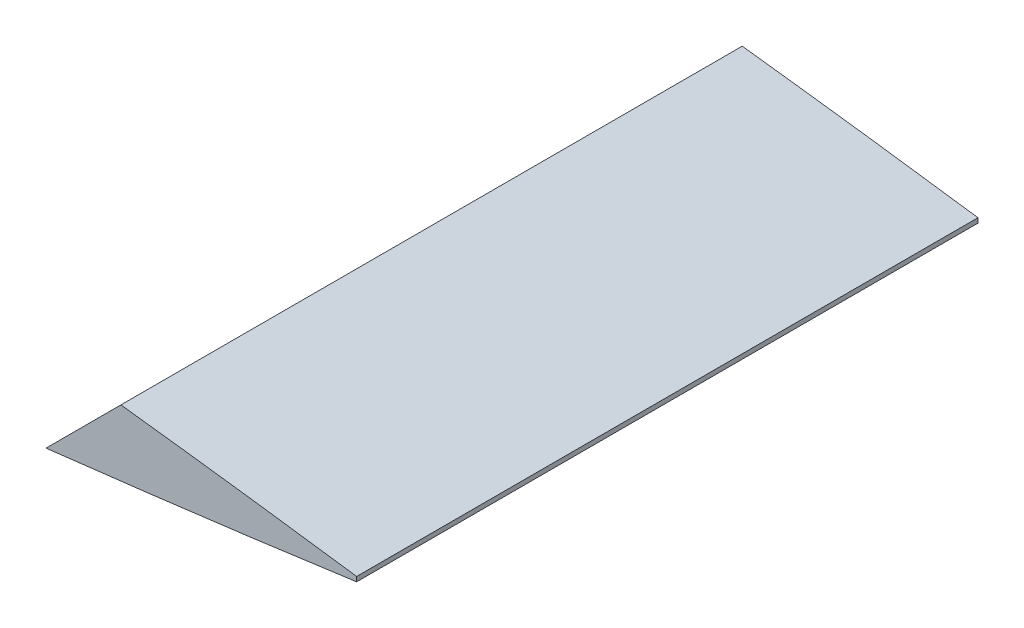
from build123d import *

# Parameters (mm, degrees)
BOSS_EXTRUDE1_DEPTH     = 100
CUT_EXTRUDE8_DEPTH      = 317.739843694
CUT_EXTRUDE8_DEPTH_BACK = 317.739843694
SKETCH9_OUTSIDE_W       = 365.654
SKETCH9_OUTSIDE_H       = 165.654
SKETCH9_OUTSIDE_W_2     = 50
SKETCH9_OUTSIDE_H_2     = 100
CUT_EXTRUDE9_DEPTH      = 317.299560542


with BuildPart() as part:
    # Sketch5 → Boss-Extrude1 (new body)
    with BuildSketch(Plane.XY):
        with BuildLine():
            Line((300, 0.378), (300, -0.378))
            add(Edge.make_bspline(
                [(300, 0.378), (299.270406424, 0.479445822), (297.234667094, 0.762503754), (293.659650161, 1.257673506), (289.112411795, 1.874242443), (284.080816659, 2.54451744), (278.752044218, 3.238122316), (273.265899022, 3.934946436), (267.705955472, 4.629019943), (262.11456302, 5.313069107), (256.508348909, 5.982191812), (250.891738994, 6.637990809), (245.269556965, 7.281779235), (239.647345349, 7.912232764), (234.025130107, 8.526992046), (228.399087903, 9.126229764), (222.768257645, 9.713077606), (217.135920793, 10.28745981), (211.505410154, 10.846941084), (205.877619803, 11.391642827), (200.251512374, 11.920884624), (194.626420536, 12.434617078), (189.002797137, 12.931911809), (183.381530938, 13.413097581), (177.763225616, 13.876376701), (172.148301533, 14.321237194), (166.537529462, 14.747820918), (160.931736194, 15.154228144), (155.33170885, 15.539100856), (149.737538345, 15.902649564), (144.148688279, 16.241846119), (138.565679604, 16.557420546), (132.990859803, 16.847397555), (127.42743944, 17.110211679), (121.877619637, 17.343891718), (116.340758577, 17.545256813), (110.815476382, 17.71267912), (105.301273398, 17.844497938), (99.800570116, 17.940091813), (94.317435844, 17.996590439), (88.855764067, 18.010124458), (83.418647975, 17.97923384), (78.008480827, 17.899160713), (72.628455365, 17.767033787), (67.282738746, 17.579413934), (61.977364895, 17.331515489), (56.720691016, 17.021032651), (51.525175322, 16.64095807), (46.408202619, 16.190188591), (41.394176065, 15.661669099), (36.515671087, 15.053963784), (31.819009441, 14.365623605), (27.366164829, 13.603475684), (23.235217954, 12.782583444), (19.502642451, 11.920250751), (16.218271393, 11.044597796), (13.389186016, 10.175076255), (10.984929333, 9.333498715), (8.961561478, 8.522062882), (7.267292053, 7.746976002), (5.846052466, 7.010625622), (4.647711085, 6.300634033), (3.628235251, 5.606513668), (2.751909197, 4.926635252), (2.00625736, 4.249917259), (1.390586137, 3.570259492), (0.901000435, 2.890942252), (0.529275535, 2.220219273), (0.260479537, 1.566458936), (0.085712654, 0.931035928), (-0.003509247, 0.308981015), (-0.003509247, -0.308981015), (0.085712654, -0.931035928), (0.260479537, -1.566458936), (0.529275535, -2.220219273), (0.901000435, -2.890942252), (1.390586137, -3.570259492), (2.00625736, -4.249917259), (2.751909197, -4.926635252), (3.628235251, -5.606513668), (4.647711085, -6.300634033), (5.846052466, -7.010625622), (7.267292053, -7.746975999), (8.961561475, -8.522062895), (10.984929344, -9.333498651), (13.389185965, -10.175076559), (16.21827163, -11.044596377), (19.502641361, -11.92025728), (23.235222799, -12.782554413), (27.366127559, -13.603596161), (31.819075008, -14.365113363), (36.515634637, -15.054106097), (41.394182204, -15.661628887), (46.408200924, -16.190199694), (51.525175786, -16.640955027), (56.720690889, -17.02103348), (61.977364929, -17.331515263), (67.282738736, -17.579413995), (72.628455367, -17.767033771), (78.008480826, -17.899160717), (83.418647975, -17.979233839), (88.855764067, -18.010124458), (94.317435844, -17.996590438), (99.800570116, -17.940091813), (105.301273398, -17.844497938), (110.815476382, -17.71267912), (116.340758577, -17.545256813), (121.877619637, -17.343891718), (127.42743944, -17.110211679), (132.990859803, -16.847397555), (138.565679604, -16.557420546), (144.148688279, -16.241846119), (149.737538345, -15.902649564), (155.33170885, -15.539100856), (160.931736194, -15.154228144), (166.537529462, -14.747820918), (172.148301533, -14.321237194), (177.763225616, -13.876376701), (183.381530938, -13.413097581), (189.002797137, -12.931911809), (194.626420536, -12.434617078), (200.251512374, -11.920884624), (205.877619803, -11.391642827), (211.505410154, -10.846941084), (217.135920793, -10.28745981), (222.768257645, -9.713077606), (228.399087903, -9.126229764), (234.025130107, -8.526992046), (239.647345349, -7.912232764), (245.269556965, -7.281779235), (250.891738994, -6.637990809), (256.508348909, -5.982191812), (262.11456302, -5.313069107), (267.705955472, -4.629019943), (273.265899022, -3.934946436), (278.752044218, -3.238122316), (284.080816659, -2.54451744), (289.112411795, -1.874242443), (293.659650161, -1.257673506), (297.234667094, -0.762503754), (299.270406424, -0.479445822), (300, -0.378)],
                knots=[0, 0, 0, 0, 0.003612221, 0.010078953, 0.017698618, 0.026115111, 0.034970966, 0.04405038, 0.05323433, 0.06244757, 0.071673993, 0.080921319, 0.090177538, 0.099424342, 0.108664441, 0.117912199, 0.127169502, 0.136426595, 0.145675426, 0.154916495, 0.164153237, 0.173386649, 0.182615736, 0.191838089, 0.201053134, 0.210260393, 0.219458942, 0.228646747, 0.237822316, 0.246985224, 0.256137384, 0.265279416, 0.27440695, 0.283512193, 0.292591781, 0.301646285, 0.310681793, 0.319699068, 0.32869452, 0.33766016, 0.346588583, 0.355477412, 0.364322937, 0.373121614, 0.381867635, 0.390553005, 0.399166026, 0.407689628, 0.416098119, 0.424354887, 0.432412429, 0.440204728, 0.447630505, 0.454563638, 0.460855379, 0.466413319, 0.47122861, 0.475365774, 0.47890126, 0.481915077, 0.484498872, 0.486747127, 0.488741252, 0.490543179, 0.492182104, 0.493672831, 0.495031908, 0.49627906, 0.497424737, 0.498490166, 0.499502758, 0.500497254, 0.501509846, 0.502575275, 0.503720952, 0.504968104, 0.506327181, 0.507817908, 0.509456832, 0.51125876, 0.513252884, 0.51550114, 0.518084934, 0.521098752, 0.524634237, 0.528771401, 0.533586692, 0.539144632, 0.545436374, 0.552369506, 0.5597952, 0.567587571, 0.575645113, 0.583901881, 0.592310372, 0.600833974, 0.609446995, 0.618132365, 0.626878386, 0.635677063, 0.644522588, 0.653411417, 0.66233984, 0.67130548, 0.680300932, 0.689318207, 0.698353715, 0.707408219, 0.716487807, 0.72559305, 0.734720584, 0.743862616, 0.753014776, 0.762177684, 0.771353253, 0.780541058, 0.789739607, 0.798946866, 0.808161911, 0.817384264, 0.826613351, 0.835846763, 0.845083505, 0.854324574, 0.863573405, 0.872830498, 0.882087801, 0.891335559, 0.900575658, 0.909822462, 0.919078681, 0.928326007, 0.93755243, 0.94676567, 0.95594962, 0.965029034, 0.973884889, 0.982301382, 0.989921047, 0.996387779, 1, 1, 1, 1], degree=3))
        make_face()
    extrude(amount=BOSS_EXTRUDE1_DEPTH)

    # Sketch9 outside → Cut-Extrude8 (cut, two sides: drawn at the far end of the back side and taken through both)
    with BuildSketch(Plane(origin=(0, 0, 0), x_dir=(1, 0, 0), z_dir=(0, 1, 0)).offset(-CUT_EXTRUDE8_DEPTH_BACK)):
        with Locations((150, -50)):
            Rectangle(SKETCH9_OUTSIDE_W, SKETCH9_OUTSIDE_H)
        with Locations((275, -50)):
            Rectangle(SKETCH9_OUTSIDE_W_2, SKETCH9_OUTSIDE_H_2, mode=Mode.SUBTRACT)
    extrude(amount=CUT_EXTRUDE8_DEPTH + CUT_EXTRUDE8_DEPTH_BACK, mode=Mode.SUBTRACT)

    # Sketch10 → Cut-Extrude9 (cut, through all)
    with BuildSketch(Plane.XY):
        Polygon((250, -6.738836522), (280, 23.261163478), (250, 23.261163478), align=None)
    extrude(amount=CUT_EXTRUDE9_DEPTH, mode=Mode.SUBTRACT)


solid = part.part
